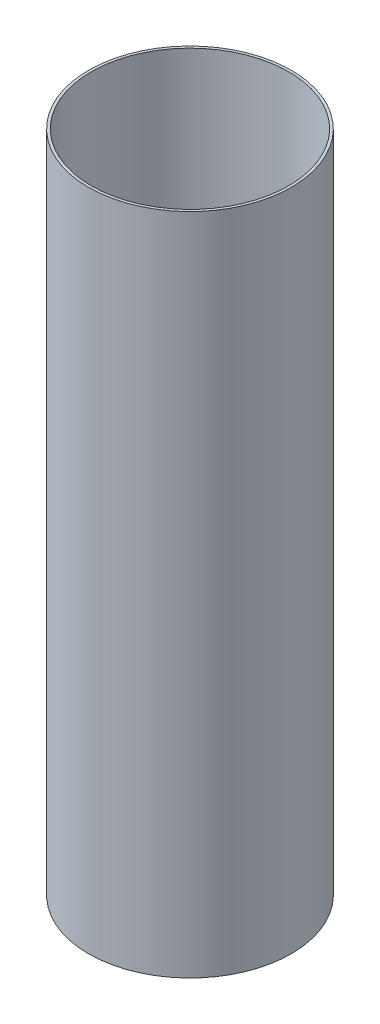
from build123d import *

# Parameters (mm, degrees)
SKETCH1_R           = 78.2
SKETCH1_R_2         = 76.2
BOSS_EXTRUDE1_DEPTH = 512


with BuildPart() as part:
    # Sketch1 → Boss-Extrude1 (new body)
    with BuildSketch(Plane(origin=(0, 0, 0), x_dir=(1, 0, 0), z_dir=(0, 1, 0))):
        with Locations(Location((0, 0, 0), (0, 0, 270))):
            Circle(SKETCH1_R)
        with Locations(Location((0, 0, 0), (0, 0, 270))):
            Circle(SKETCH1_R_2, mode=Mode.SUBTRACT)
    extrude(amount=BOSS_EXTRUDE1_DEPTH)


solid = part.part
